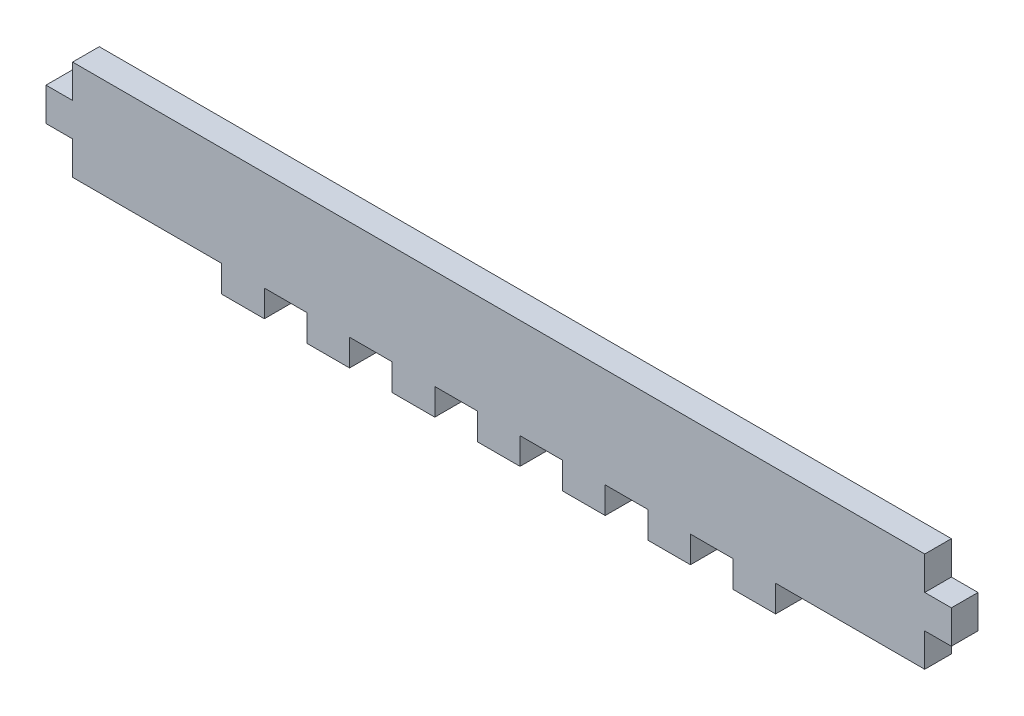
from build123d import *

# Parameters (mm, degrees)
BOSS_EXTRUDE1_DEPTH = 3.175


with BuildPart() as part:
    # Sketch1 → Boss-Extrude1 (new body)
    with BuildSketch(Plane.XY):
        Polygon((-50.8, -5.953125), (-33.02, -5.953125), (-33.02, -9.128125), (-27.94, -9.128125), (-27.94, -5.953125), (-22.86, -5.953125), (-22.86, -9.128125), (-17.78, -9.128125), (-17.78, -5.953125), (-12.7, -5.953125), (-12.7, -9.128125), (-7.62, -9.128125), (-7.62, -5.953125), (-2.54, -5.953125), (-2.54, -9.128125), (2.54, -9.128125), (2.54, -5.953125), (7.62, -5.953125), (7.62, -9.128125), (12.7, -9.128125), (12.7, -5.953125), (17.78, -5.953125), (17.78, -9.128125), (22.86, -9.128125), (22.86, -5.953125), (27.94, -5.953125), (27.94, -9.128125), (33.02, -9.128125), (33.02, -5.953125), (50.8, -5.953125), (50.8, -1.984375), (53.975, -1.984375), (53.975, 1.984375), (50.8, 1.984375), (50.8, 5.953125), (-50.8, 5.953125), (-50.8, 1.984375), (-53.975, 1.984375), (-53.975, -1.984375), (-50.8, -1.984375), align=None)
    extrude(amount=BOSS_EXTRUDE1_DEPTH)


solid = part.part
